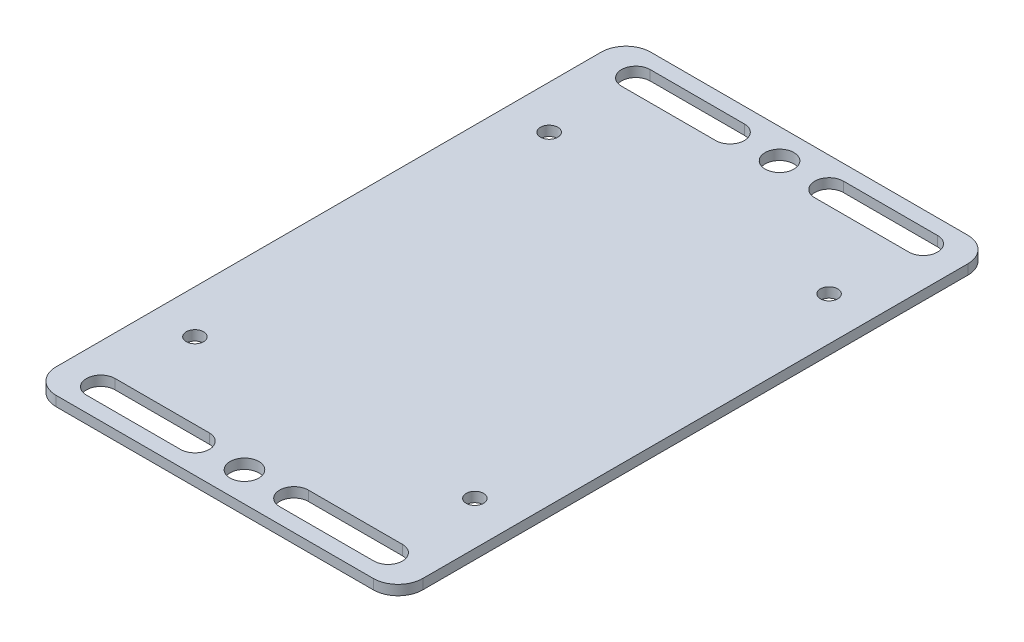
from build123d import *

# Parameters (mm, degrees)
SKETCH1_W           = 74
SKETCH1_H           = 120
BOSS_EXTRUDE1_DEPTH = 2
SKETCH3_R           = 2.9
CUT_EXTRUDE1_DEPTH  = 71.519500849
FILLET1_R           = 5
SKETCH5_R           = 1.75
CUT_EXTRUDE2_DEPTH  = 71.519500849


with BuildPart() as part:
    # Sketch1 → Boss-Extrude1 (new body)
    with BuildSketch(Plane(origin=(0, 0, 0), x_dir=(1, 0, 0), z_dir=(0, 1, 0))):
        Rectangle(SKETCH1_W, SKETCH1_H)
    extrude(amount=BOSS_EXTRUDE1_DEPTH)

    # Sketch3 → Cut-Extrude1 (cut, through all)
    with BuildSketch(Plane(origin=(0, 2, 0), x_dir=(1, 0, 0), z_dir=(0, 1, 0))):
        with Locations(Location((0, 54, 0), (0, 0, 270))):
            Circle(SKETCH3_R)
        with BuildLine():
            Line((-29, 56.9), (-10, 56.9))
            ThreePointArc((-10, 56.9), (-7.1, 54), (-10, 51.1))
            Line((-10, 51.1), (-29, 51.1))
            ThreePointArc((-29, 51.1), (-31.9, 54), (-29, 56.9))
        make_face()
        with BuildLine():
            Line((10, 56.9), (29, 56.9))
            ThreePointArc((29, 56.9), (31.9, 54), (29, 51.1))
            Line((29, 51.1), (10, 51.1))
            ThreePointArc((10, 51.1), (7.1, 54), (10, 56.9))
        make_face()
    cut_extrude1 = extrude(amount=-CUT_EXTRUDE1_DEPTH, mode=Mode.SUBTRACT)

    # Mirror1: Cut-Extrude1 across plane
    add(cut_extrude1.mirror(Plane.XY), mode=Mode.SUBTRACT)

    # Fillet1
    fillet1_edges = [part.edges().sort_by_distance(p)[0] for p in [
        (37, 1, 60),
        (-37, 1, 60),
        (-37, 1, -60),
        (37, 1, -60),
    ]]
    fillet(fillet1_edges, radius=FILLET1_R)

    # Sketch5 → Cut-Extrude2 (cut, through all)
    with BuildSketch(Plane(origin=(0, 2, 0), x_dir=(1, 0, 0), z_dir=(0, 1, 0))):
        with Locations(Location((-28.25, 35.75, 0), (0, 0, 270))):
            Circle(SKETCH5_R)
        with Locations(Location((28.25, 35.75, 0), (0, 0, 270))):
            Circle(SKETCH5_R)
        with Locations(Location((-28.25, -35.75, 0), (0, 0, 270))):
            Circle(SKETCH5_R)
        with Locations(Location((28.25, -35.75, 0), (0, 0, 270))):
            Circle(SKETCH5_R)
    extrude(amount=-CUT_EXTRUDE2_DEPTH, mode=Mode.SUBTRACT)


solid = part.part
